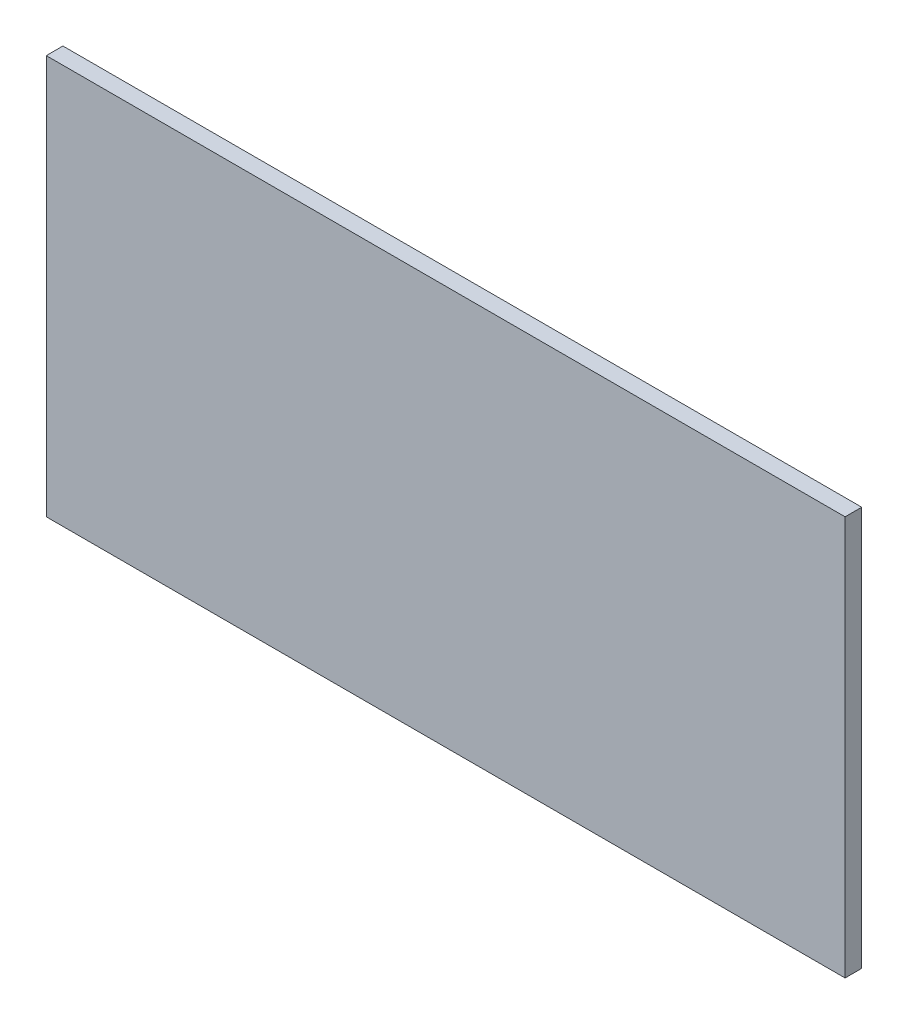
from build123d import *

# Parameters (mm, degrees)
SKETCH1_W           = 1200
SKETCH1_H           = 600
BOSS_EXTRUDE1_DEPTH = 25


with BuildPart() as part:
    # Sketch1 → Boss-Extrude1 (new body)
    with BuildSketch(Plane.XY):
        Rectangle(SKETCH1_W, SKETCH1_H)
    extrude(amount=-BOSS_EXTRUDE1_DEPTH)


solid = part.part
